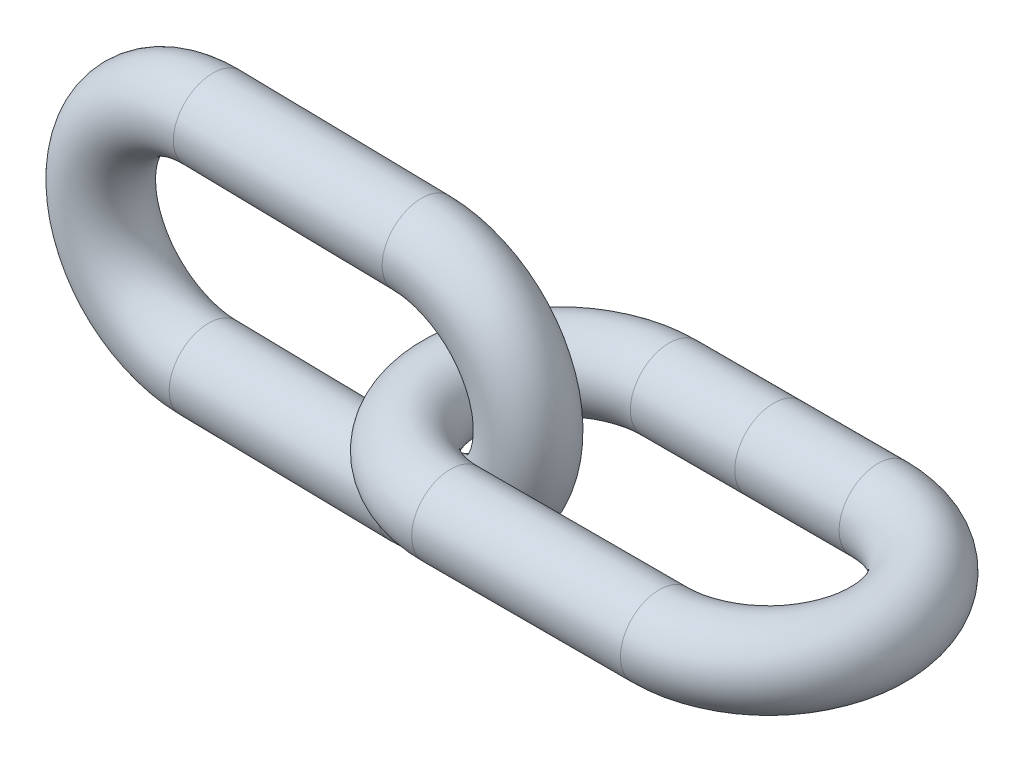
from build123d import *

# Parameters (mm, degrees)
SKETCH2_R = 3.4925
SKETCH6_R = 3.4925


with BuildPart() as part:
    # Sweep1: sweep along a path in Sketch1
    with BuildLine(Plane(origin=(0, 0, 0), x_dir=(1, 0, 0), z_dir=(0, 1, 0))) as sweep1_path:
        Line((9.398, 9.8425), (-9.398, 9.8425))
        ThreePointArc((-9.398, 9.8425), (-19.2405, 0), (-9.398, -9.8425))
        Line((-9.398, -9.8425), (9.398, -9.8425))
        ThreePointArc((9.398, -9.8425), (19.2405, 0), (9.398, 9.8425))
    # Sketch2 → Sweep1 (sweep)
    with BuildSketch(Plane(origin=(0, 0, 0), x_dir=(0, 0, -1), z_dir=(1, 0, 0))):
        with Locations((9.8425, 0)):
            Circle(SKETCH2_R)
    sweep(path=sweep1_path.line)


with BuildPart() as body_2:
    # Sweep2: sweep along a path in Sketch5
    with BuildLine(Plane.XY) as sweep2_path:
        Line((-21.906026745, 9.98887708), (-40.698592944, 10.348142532))
        ThreePointArc((-40.698592944, 10.348142532), (-50.727423708, 0.695569507), (-41.074850682, -9.333261257))
        Line((-41.074850682, -9.333261257), (-22.282284483, -9.69252671))
        ThreePointArc((-22.282284483, -9.69252671), (-12.25345372, -0.039953684), (-21.906026745, 9.98887708))
    # Sketch6 → Sweep2 (sweep)
    with BuildSketch(Plane(origin=(-21.906026745, 9.98887708, 0), x_dir=(0, 0, 1), z_dir=(-0.9998173121277764, 0.0191139312960121, 0))):
        Circle(SKETCH6_R)
    sweep(path=sweep2_path.line)


solid = Compound([part.part, body_2.part])
